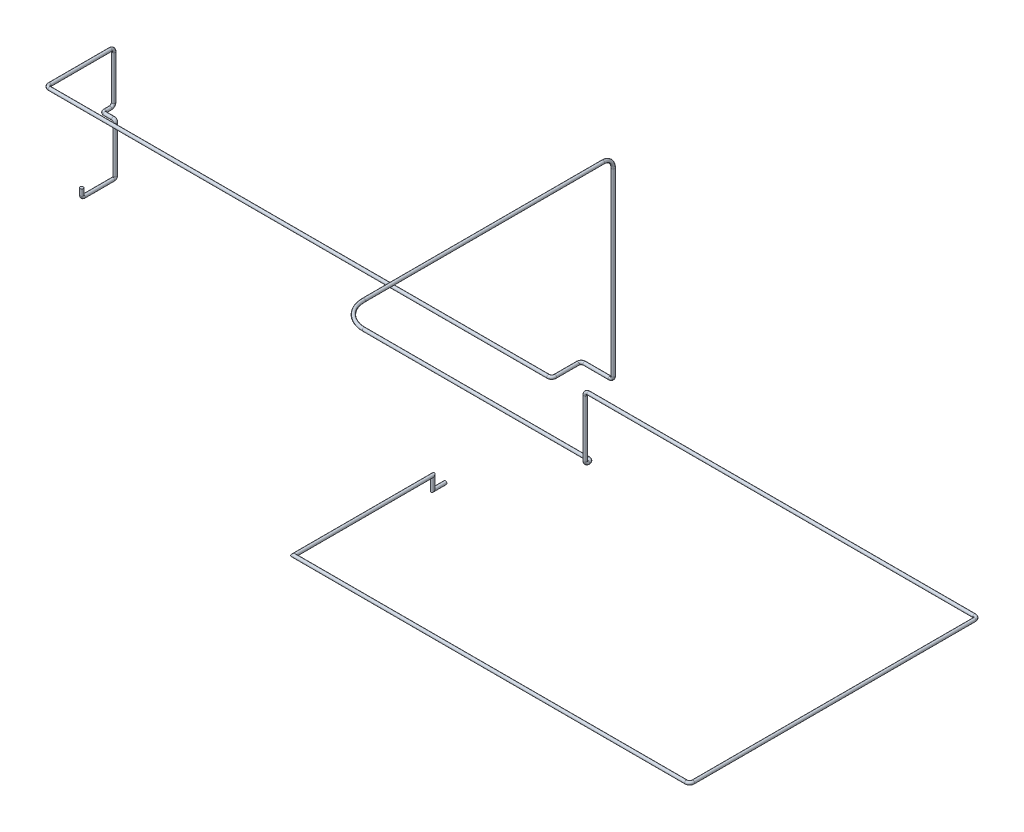
from build123d import *

# Parameters (mm, degrees)
CROQUIS1_R              = 19.05
SALIENTE_EXTRUIR1_DEPTH = 10
CROQUIS2_R              = 19.05
CROQUIS3_R              = 19.05


with BuildPart() as part:
    # Croquis1 → Saliente-Extruir1 (new body)
    with BuildSketch(Plane.XY):
        Circle(CROQUIS1_R)
    extrude(amount=-SALIENTE_EXTRUIR1_DEPTH)

    # Barrer1: sweep along a curve in space
    with BuildLine() as barrer1_path:
        Line((0, 0, -10), (0, 0, -30))
        ThreePointArc((0, 0, -30), (0, 11.715728753, -58.284271247), (0, 40, -70))
        Line((0, 40, -70), (0, 560, -70))
        ThreePointArc((0, 560, -70), (0, 588.284271247, -58.284271247), (0, 600, -30))
        Line((0, 600, -30), (0, 600, 690))
        ThreePointArc((0, 600, 690), (11.715728753, 600, 718.284271247), (40, 600, 730))
        Line((40, 600, 730), (5960, 600, 730))
        ThreePointArc((5960, 600, 730), (5988.284271247, 600, 718.284271247), (6000, 600, 690))
        Line((6000, 600, 690), (6000, 600, 420))
        ThreePointArc((6000, 600, 420), (6011.715728753, 600, 391.715728753), (6040, 600, 380))
        Line((6040, 600, 380), (6340, 600, 380))
        ThreePointArc((6340, 600, 380), (6368.284271247, 611.715728753, 380), (6380, 640, 380))
        Line((6380, 640, 380), (6380, 2780, 380))
        ThreePointArc((6380, 2780, 380), (6380, 2864.852813742, 415.147186258), (6380, 2900, 500))
        Line((6380, 2900, 500), (6380, 2900, 3340))
        ThreePointArc((6380, 2900, 3340), (6467.867965644, 2900, 3552.132034356), (6680, 2900, 3640))
        Line((6680, 2900, 3640), (9345, 2900, 3640))
        ThreePointArc((9345, 2900, 3640), (9369.748737342, 2900, 3650.251262658), (9380, 2900, 3675))
        Line((9380, 2900, 3675), (9380, 2900, 3677))
        ThreePointArc((9380, 2900, 3677), (9380, 2910.251262658, 3701.748737342), (9380, 2935, 3712))
        Line((9380, 2935, 3712), (9380, 3610, 3712))
        ThreePointArc((9380, 3610, 3712), (9391.715728753, 3638.284271247, 3712), (9420, 3650, 3712))
        Line((9420, 3650, 3712), (14000, 3650, 3712))
        ThreePointArc((14000, 3650, 3712), (14028.284271247, 3650, 3723.715728753), (14040, 3650, 3752))
        Line((14040, 3650, 3752), (14040, 3650, 7092))
        ThreePointArc((14040, 3650, 7092), (14028.284271247, 3650, 7120.284271247), (14000, 3650, 7132))
        Line((14000, 3650, 7132), (9340, 3650, 7132))
        Line((9340, 3650, 7132), (9340, 3650, 5482))
        Line((9340, 3650, 5482), (9340, 3500, 5482))
        Line((9340, 3500, 5482), (9340, 3500, 5332))
    # Croquis2 → Barrer1 (sweep)
    with BuildSketch(Plane(origin=(0, 0, -10), x_dir=(-1, 0, 0), z_dir=(0, 0, -1))):
        Circle(CROQUIS2_R)
    sweep(path=barrer1_path.line, transition=Transition.RIGHT)

    # Barrer2: sweep along a curve in space
    with BuildLine() as barrer2_path:
        Line((0, 0, 0), (0, 0, 35))
        ThreePointArc((0, 0, 35), (7.32233047, 0, 52.67766953), (25, 0, 60))
        Line((25, 0, 60), (125, 0, 60))
        ThreePointArc((125, 0, 60), (142.67766953, -7.32233047, 60), (150, -25, 60))
        Line((150, -25, 60), (150, -575, 60))
        ThreePointArc((150, -575, 60), (150, -592.67766953, 67.32233047), (150, -600, 85))
        Line((150, -600, 85), (150, -600, 435))
        ThreePointArc((150, -600, 435), (150, -592.67766953, 452.67766953), (150, -575, 460))
        Line((150, -575, 460), (150, -500, 460))
    # Croquis3 → Barrer2 (sweep)
    with BuildSketch(Plane.XY):
        Circle(CROQUIS3_R)
    sweep(path=barrer2_path.line)


solid = part.part
